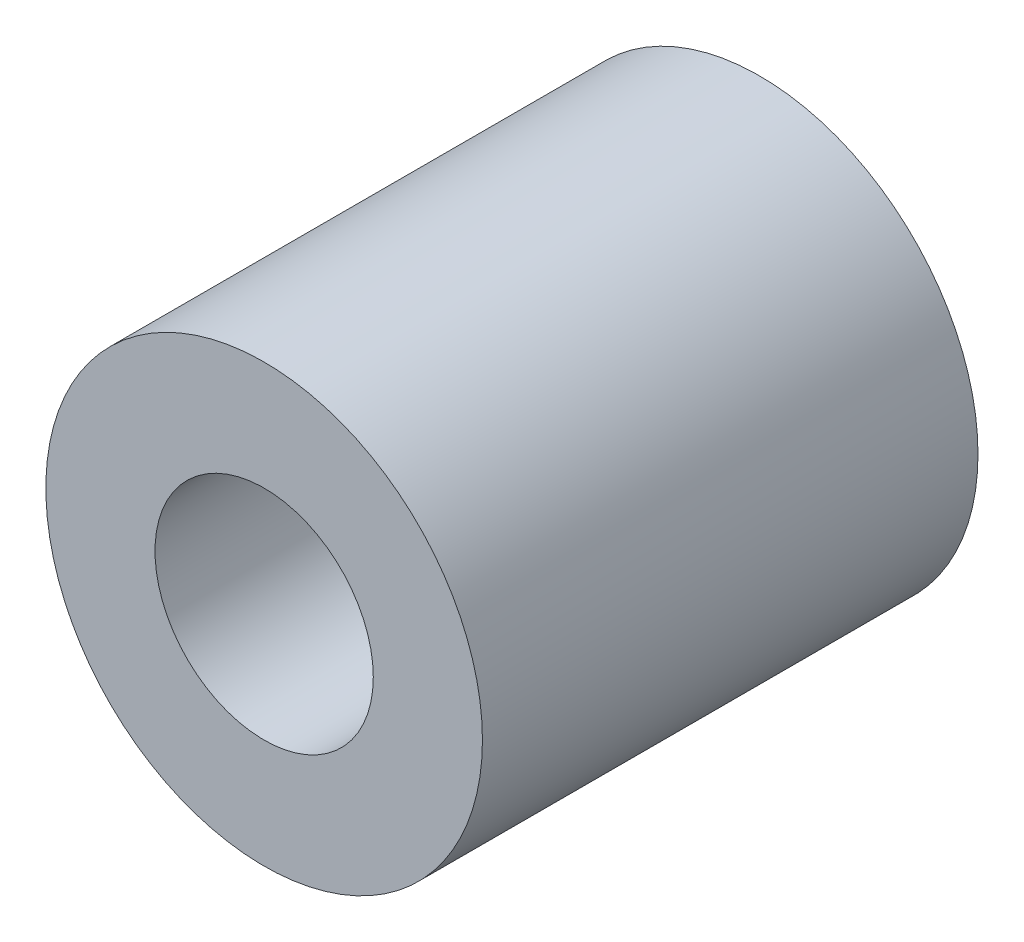
from build123d import *

# Parameters (mm, degrees)
SKETCH_1_R      = 5
SKETCH_1_R_2    = 2.5
EXTRUDE_1_DEPTH = 11.35


with BuildPart() as part:
    # 스케치1 → 보스-돌출1 (new body)
    with BuildSketch(Plane.XY):
        Circle(SKETCH_1_R)
        Circle(SKETCH_1_R_2, mode=Mode.SUBTRACT)
    extrude(amount=EXTRUDE_1_DEPTH)


solid = part.part
